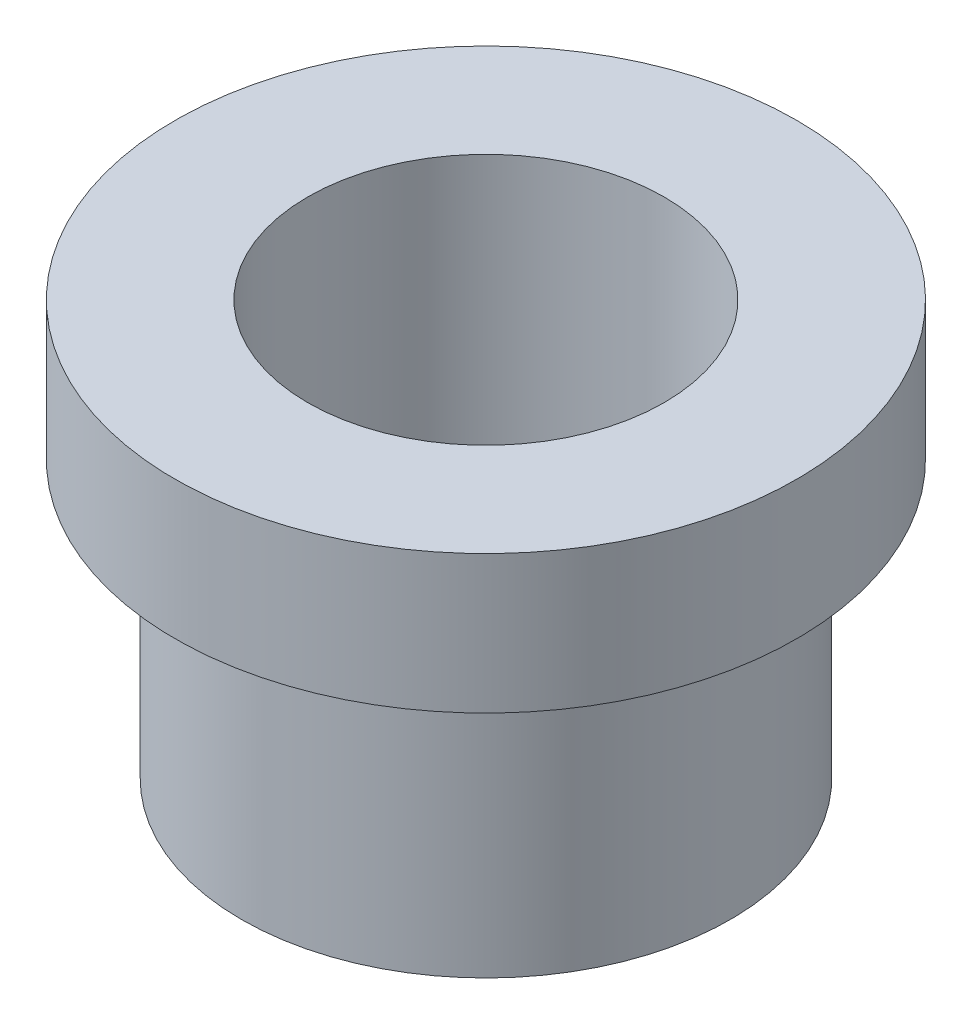
from build123d import *

# Parameters (mm, degrees)
SKETCH2_R           = 28.575
SKETCH2_R_2         = 16.383
BOSS_EXTRUDE1_DEPTH = 12.7
BOSS_EXTRUDE2_START = -25.4
SKETCH3_R           = 22.479
SKETCH3_R_2         = 16.383
BOSS_EXTRUDE2_DEPTH = 25.4


with BuildPart() as part:
    # Sketch2 → Boss-Extrude1 (new body)
    with BuildSketch(Plane(origin=(0, 0, 0), x_dir=(1, 0, 0), z_dir=(0, 1, 0))):
        with Locations(Location((0, 0, 0), (0, 0, 90))):
            Circle(SKETCH2_R)
        with Locations(Location((0, 0, 0), (0, 0, 90))):
            Circle(SKETCH2_R_2, mode=Mode.SUBTRACT)
    extrude(amount=BOSS_EXTRUDE1_DEPTH)

    # Sketch3 → Boss-Extrude2 (add)
    with BuildSketch(Plane(origin=(0, 0, 0), x_dir=(1, 0, 0), z_dir=(0, 1, 0)).offset(BOSS_EXTRUDE2_START)):
        with Locations(Location((0, 0, 0), (0, 0, 270))):
            Circle(SKETCH3_R)
        with Locations(Location((0, 0, 0), (0, 0, 90))):
            Circle(SKETCH3_R_2, mode=Mode.SUBTRACT)
    extrude(amount=BOSS_EXTRUDE2_DEPTH)


solid = part.part
